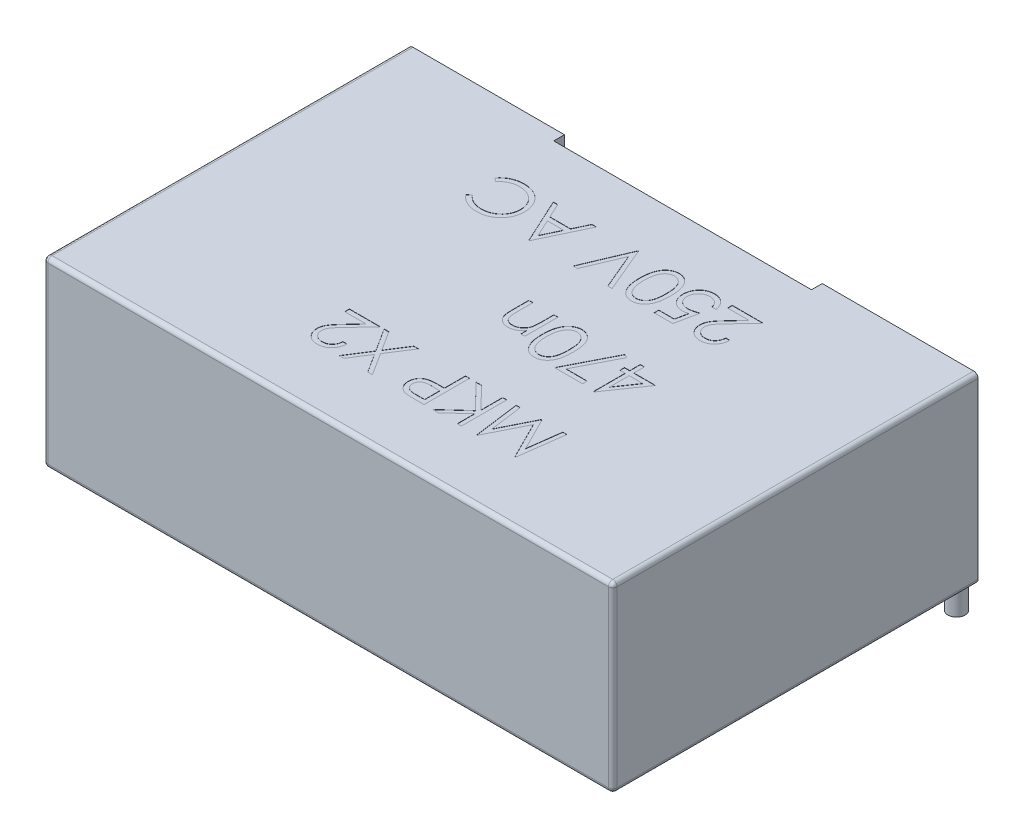
from build123d import *

# Parameters (mm, degrees)
SKETCH1_W          = 26.5
SKETCH1_H          = 8.5
EXTRUDE1_DEPTH     = 17
FILLET1_R          = 0.2
CUT_EXTRUDE1_DEPTH = 0.01
SKETCH5_R          = 0.4
SKETCH6_W          = 12
SKETCH6_H          = 8.5
CUT_EXTRUDE2_DEPTH = 0.5
SKETCH7_W          = 25.5
SKETCH7_H          = 7.563160836
CUT_EXTRUDE4_DEPTH = 0.6


with BuildPart() as part:
    # Sketch1 → Extrude1 (new body)
    with BuildSketch(Plane.XY):
        with Locations((0, 4.25)):
            Rectangle(SKETCH1_W, SKETCH1_H)
    extrude(amount=EXTRUDE1_DEPTH)

    # Fillet1
    fillet1_edges = [part.edges().sort_by_distance(p)[0] for p in [
        (13.25, 4.25, 17),
        (0, 8.5, 17),
        (-13.25, 4.25, 17),
        (0, 0, 17),
        (-13.25, 8.5, 8.5),
        (13.25, 8.5, 8.5),
        (13.25, 0, 8.5),
        (-13.25, 0, 8.5),
    ]]
    fillet(fillet1_edges, radius=FILLET1_R)

    # Sketch3 → Cut-Extrude1 (cut)
    # profile 1 of 15: a face of its own
    with BuildSketch(Plane.XZ.offset(-8.5)):
        Polygon((6.142382605, 12.028879481), (5.86295886, 14.145546148), (5.835822108, 14.145546148), (4.961933887, 12.408794011), (4.090165724, 14.145546148), (4.06260496, 14.145546148), (3.781485169, 12.028879481), (3.972290457, 12.028879481), (4.174968075, 13.551929695), (4.939037252, 12.028879481), (4.981862439, 12.028879481), (5.748899699, 13.555321789), (5.951153304, 12.028879481), align=None)
    # profile 2 of 15: a face of its own
    with BuildSketch(Plane.XZ.offset(-8.5)):
        Polygon((3.347297134, 14.145546148), (3.157339869, 14.145546148), (3.157339869, 13.339499807), (2.274971413, 14.145546148), (2.004027904, 14.145546148), (3.044128732, 13.195759823), (1.922617647, 12.028879481), (2.175752663, 12.028879481), (3.157339869, 13.050323792), (3.157339869, 12.028879481), (3.347297134, 12.028879481), align=None)
    # profile 3 of 15: a face of its own
    with BuildSketch(Plane.XZ.offset(-8.5)):
        with BuildLine():
            Line((1.610544998, 14.145546148), (1.195437492, 14.145546148))
            add(Edge.make_bspline(
                [(1.195437492, 14.145546148), (1.166886135, 14.145514763), (1.112180466, 14.145454628), (1.033733742, 14.143631424), (0.962486904, 14.141196234), (0.898593578, 14.137820518), (0.841857176, 14.133831152), (0.792534428, 14.128235871), (0.750237649, 14.122393692), (0.724894225, 14.116454079), (0.71333613, 14.113745266)],
                knots=[0, 0, 0, 0, 1.415646017, 2.712440637, 3.8905458, 4.950247383, 5.884950622, 6.709939814, 7.411656543, 8, 8, 8, 8], degree=3))
            add(Edge.make_bspline(
                [(0.71333613, 14.113745266), (0.698704803, 14.109740563), (0.669786916, 14.101825523), (0.62811819, 14.085972462), (0.588473722, 14.067175152), (0.550717494, 14.045752103), (0.515313472, 14.020784166), (0.481733438, 13.993283455), (0.450273735, 13.96261503), (0.421111275, 13.929122868), (0.394329516, 13.893369217), (0.371270136, 13.854820345), (0.351961766, 13.814125128), (0.335401406, 13.771311873), (0.323482484, 13.726021059), (0.314503645, 13.67856738), (0.308804594, 13.628955925), (0.308258759, 13.595053052), (0.307980895, 13.577794411)],
                knots=[0, 0, 0, 0, 0.999701418, 1.975846123, 2.934577507, 3.890451536, 4.834027766, 5.787354733, 6.749476667, 7.726910423, 8.712836071, 9.690891519, 10.682875813, 11.679750201, 12.712814741, 13.765529915, 14.8625177, 16, 16, 16, 16], degree=3))
            add(Edge.make_bspline(
                [(0.307980895, 13.577794411), (0.308235757, 13.560390708), (0.308734411, 13.526339188), (0.314719307, 13.476523263), (0.322780899, 13.42891738), (0.335176736, 13.383627093), (0.351411976, 13.340921365), (0.37045717, 13.300147573), (0.393428162, 13.26199939), (0.419822892, 13.226338324), (0.449185047, 13.193130901), (0.481390395, 13.162617763), (0.51630892, 13.13497752), (0.553829648, 13.110148208), (0.594318366, 13.0887056), (0.637161001, 13.069499992), (0.682729942, 13.053370351), (0.714263748, 13.044885504), (0.7302966, 13.040571521)],
                knots=[0, 0, 0, 0, 1.121902311, 2.195077645, 3.232258892, 4.234102512, 5.217864754, 6.176164875, 7.132989551, 8.084763148, 9.034132444, 9.988522005, 10.94243251, 11.903244335, 12.886203696, 13.894208494, 14.929344452, 16, 16, 16, 16], degree=3))
            add(Edge.make_bspline(
                [(0.7302966, 13.040571521), (0.743557417, 13.037751528), (0.772619266, 13.031571349), (0.82048177, 13.024671949), (0.876207789, 13.018783019), (0.939721263, 13.014367569), (1.010965182, 13.010587584), (1.089978085, 13.00758307), (1.176915074, 13.005932159), (1.237555303, 13.005847013), (1.269215537, 13.005802558)],
                knots=[0, 0, 0, 0, 0.601384939, 1.31797006, 2.144135048, 3.087295005, 4.142315834, 5.309527816, 6.595305764, 8, 8, 8, 8], degree=3))
            Line((1.269215537, 13.005802558), (1.420587733, 13.005802558))
            Line((1.420587733, 13.005802558), (1.420587733, 12.028879481))
            Line((1.420587733, 12.028879481), (1.610544998, 12.028879481))
            Line((1.610544998, 12.028879481), (1.610544998, 14.145546148))
        make_face()
        with BuildLine():
            Line((1.420587733, 13.92845213), (1.420587733, 13.222896575))
            Line((1.420587733, 13.222896575), (1.050001461, 13.218232446))
            add(Edge.make_bspline(
                [(1.050001461, 13.218232446), (1.03190703, 13.218223094), (0.996976103, 13.21820504), (0.946517054, 13.220615152), (0.899702866, 13.223397379), (0.856677337, 13.227471008), (0.817421072, 13.233229102), (0.781868614, 13.239041915), (0.750295638, 13.247451349), (0.713345169, 13.258774348), (0.672170954, 13.278085977), (0.627377722, 13.306116625), (0.589416463, 13.341846387), (0.556566826, 13.382019408), (0.530498033, 13.426710787), (0.511414171, 13.474528668), (0.500201185, 13.524982653), (0.49869763, 13.559507384), (0.49793816, 13.576946388)],
                knots=[0, 0, 0, 0, 1.160613943, 2.240541288, 3.23993089, 4.169200891, 5.011653406, 5.7853311, 6.478053781, 7.106038997, 8.262395093, 9.384106736, 10.481365981, 11.59014053, 12.70357646, 13.786202915, 14.881775077, 16, 16, 16, 16], degree=3))
            add(Edge.make_bspline(
                [(0.49793816, 13.576946388), (0.498701761, 13.593963489), (0.500219704, 13.62779138), (0.511502059, 13.677369011), (0.53046093, 13.724682985), (0.556741823, 13.768814327), (0.588637649, 13.808842794), (0.625709157, 13.843614866), (0.667869081, 13.871567991), (0.707086821, 13.889610023), (0.741921824, 13.900625928), (0.772179247, 13.908333522), (0.806342655, 13.914487341), (0.84442317, 13.919470278), (0.886125636, 13.923735943), (0.931808331, 13.92663032), (0.981298201, 13.928324534), (1.01565507, 13.928408568), (1.033465003, 13.92845213)],
                knots=[0, 0, 0, 0, 1.120700087, 2.227813068, 3.331159281, 4.466773991, 5.599788987, 6.693661531, 7.80175334, 8.91857717, 9.525282508, 10.207424825, 10.974604443, 11.810962634, 12.737642355, 13.736264703, 14.826523623, 16, 16, 16, 16], degree=3))
            Line((1.033465003, 13.92845213), (1.420587733, 13.92845213))
        make_face(mode=Mode.SUBTRACT)
    # profile 4 of 15: a face of its own
    with BuildSketch(Plane.XZ.offset(-8.5)):
        Polygon((-0.791057566, 14.145546148), (-1.010271642, 14.145546148), (-1.564455002, 13.27971415), (-2.118638362, 14.145546148), (-2.337852438, 14.145546148), (-1.674274046, 13.108413402), (-2.36498919, 12.028879481), (-2.145775114, 12.028879481), (-1.564455002, 12.937112654), (-0.98313489, 12.028879481), (-0.763920814, 12.028879481), (-1.45505997, 13.108413402), align=None)
    # profile 5 of 15: a face of its own
    with BuildSketch(Plane.XZ.offset(-8.5)):
        with BuildLine():
            Line((-2.812745601, 13.494264096), (-2.622788336, 13.494264096))
            add(Edge.make_bspline(
                [(-2.622788336, 13.494264096), (-2.624026376, 13.519465062), (-2.626457854, 13.568959087), (-2.637844486, 13.64112164), (-2.654137302, 13.710097637), (-2.677173562, 13.775333252), (-2.705782597, 13.837405293), (-2.740090756, 13.896067207), (-2.780727037, 13.951095211), (-2.826813967, 14.001979179), (-2.876869287, 14.048659281), (-2.930878117, 14.088969833), (-2.987632014, 14.123028615), (-3.046958794, 14.151501556), (-3.109527801, 14.172873749), (-3.174771244, 14.188731597), (-3.242975769, 14.19827253), (-3.289445687, 14.199298077), (-3.313079468, 14.199819652)],
                knots=[0, 0, 0, 0, 1.10065271, 2.161652631, 3.183658789, 4.190468796, 5.17591951, 6.163126047, 7.15150782, 8.156236427, 9.156009102, 10.134482811, 11.092018607, 12.041330605, 13.001268258, 13.972401359, 14.968799086, 16, 16, 16, 16], degree=3))
            add(Edge.make_bspline(
                [(-3.313079468, 14.199819652), (-3.336289065, 14.1992763), (-3.381895095, 14.198208632), (-3.448456408, 14.189039819), (-3.511821724, 14.17467939), (-3.571867183, 14.154531495), (-3.628113708, 14.127447579), (-3.680983835, 14.094912877), (-3.731106992, 14.057284694), (-3.776226332, 14.012983578), (-3.817657409, 13.965689755), (-3.853400201, 13.915199451), (-3.884009114, 13.863051264), (-3.909522616, 13.808847542), (-3.928304186, 13.75207792), (-3.942563388, 13.693568898), (-3.9506233, 13.632714845), (-3.951860294, 13.591526595), (-3.95248919, 13.570586212)],
                knots=[0, 0, 0, 0, 1.111607364, 2.184268762, 3.212621178, 4.221274766, 5.211760367, 6.196651075, 7.1921475, 8.207485113, 9.220403448, 10.201281604, 11.166441695, 12.114753415, 13.065576456, 14.026450734, 14.996634279, 16, 16, 16, 16], degree=3))
            add(Edge.make_bspline(
                [(-3.95248919, 13.570586212), (-3.951465169, 13.541105378), (-3.949435098, 13.482661059), (-3.932069737, 13.39677588), (-3.904948275, 13.313564622), (-3.872292731, 13.24659492), (-3.839349872, 13.192629902), (-3.809663617, 13.148198828), (-3.774911089, 13.100358854), (-3.734586473, 13.049270179), (-3.689523927, 12.994532632), (-3.639315285, 12.936179279), (-3.583602513, 12.874813018), (-3.544499515, 12.832899631), (-3.524237321, 12.811181164)],
                knots=[0, 0, 0, 0, 1.184426356, 2.348067706, 3.509069118, 4.696110526, 5.333549288, 6.050745305, 6.844228056, 7.710549037, 8.667450064, 9.695053472, 10.805634456, 12, 12, 12, 12], degree=3))
            Line((-3.524237321, 12.811181164), (-2.994646642, 12.245973498))
            Line((-2.994646642, 12.245973498), (-3.979625942, 12.245973498))
            Line((-3.979625942, 12.245973498), (-3.979625942, 12.028879481))
            Line((-3.979625942, 12.028879481), (-2.541378079, 12.028879481))
            Line((-2.541378079, 12.028879481), (-3.362264831, 12.904887761))
            add(Edge.make_bspline(
                [(-3.362264831, 12.904887761), (-3.382250934, 12.925751022), (-3.420640148, 12.965825078), (-3.47493723, 13.024331535), (-3.523704618, 13.078608638), (-3.567257994, 13.128553836), (-3.604652542, 13.174897689), (-3.637837178, 13.216139248), (-3.664425892, 13.254090749), (-3.693282346, 13.298081501), (-3.721230801, 13.351791807), (-3.745247321, 13.417428848), (-3.759891539, 13.484997234), (-3.761648273, 13.53065799), (-3.762531925, 13.553625742)],
                knots=[0, 0, 0, 0, 1.329631726, 2.553950428, 3.673215718, 4.687767853, 5.603093632, 6.413772471, 7.123043292, 7.734684054, 8.834405432, 9.900288307, 10.943827018, 12, 12, 12, 12], degree=3))
            add(Edge.make_bspline(
                [(-3.762531925, 13.553625742), (-3.762147453, 13.568068302), (-3.761389731, 13.596531814), (-3.754702457, 13.638263868), (-3.744596579, 13.678519732), (-3.730115399, 13.71742323), (-3.711000847, 13.75458322), (-3.687733612, 13.790044934), (-3.660888193, 13.82432826), (-3.629832902, 13.85647335), (-3.595717363, 13.885913889), (-3.559677032, 13.911993693), (-3.52154673, 13.933788774), (-3.481487228, 13.951655556), (-3.439610206, 13.965671143), (-3.39583467, 13.97538276), (-3.350281574, 13.981480263), (-3.319176555, 13.982305262), (-3.303327198, 13.982725635)],
                knots=[0, 0, 0, 0, 0.991446411, 1.95395049, 2.89581595, 3.838931463, 4.798493298, 5.75982156, 6.748411868, 7.785213223, 8.824556874, 9.840280684, 10.836137867, 11.835679398, 12.848801643, 13.863922112, 14.911575587, 16, 16, 16, 16], degree=3))
            add(Edge.make_bspline(
                [(-3.303327198, 13.982725635), (-3.286774361, 13.98229321), (-3.254267322, 13.981444001), (-3.206540098, 13.975503628), (-3.161010127, 13.965255429), (-3.117562881, 13.951239059), (-3.076124846, 13.933423651), (-3.036897543, 13.911233882), (-2.999969034, 13.884755293), (-2.965269898, 13.854734575), (-2.933299778, 13.821310836), (-2.905210477, 13.784051477), (-2.880666811, 13.743636802), (-2.859252655, 13.70017586), (-2.84186231, 13.653274288), (-2.828573785, 13.603098581), (-2.818058883, 13.549866602), (-2.814546111, 13.513106099), (-2.812745601, 13.494264096)],
                knots=[0, 0, 0, 0, 1.031018746, 2.02475058, 2.990194455, 3.934040569, 4.864654155, 5.795059489, 6.735614925, 7.690564532, 8.649604399, 9.611025574, 10.590972636, 11.591080095, 12.624614302, 13.701020113, 14.821632451, 16, 16, 16, 16], degree=3))
        make_face()
    # profile 6 of 15: a face of its own
    with BuildSketch(Plane.XZ.offset(-8.5)):
        Polygon((5.068360836, 9.672041874), (5.029775767, 9.672041874), (5.029775767, 8.206657259), (4.785544998, 8.206657259), (4.785544998, 7.989563242), (5.029775767, 7.989563242), (5.029775767, 7.501101703), (5.219733032, 7.501101703), (5.219733032, 7.989563242), (6.223792861, 7.989563242), align=None)
        Polygon((5.219733032, 8.206657259), (5.219733032, 9.125914737), (5.850662519, 8.206657259), align=None, mode=Mode.SUBTRACT)
    # profile 7 of 15: a face of its own
    with BuildSketch(Plane.XZ.offset(-8.5)):
        Polygon((4.459903972, 9.61776837), (3.157339869, 9.61776837), (4.269946707, 7.446828199), (4.434039255, 7.537142702), (3.478740778, 9.400674353), (4.459903972, 9.400674353), align=None)
    # profile 8 of 15: a face of its own
    with BuildSketch(Plane.XZ.offset(-8.5)):
        with BuildLine():
            add(Edge.make_bspline(
                [(2.967382605, 8.558587013), (2.967184232, 8.592512576), (2.966798889, 8.658413471), (2.962512082, 8.754440374), (2.955390804, 8.844525882), (2.945631536, 8.928674308), (2.933755233, 9.006907375), (2.917901106, 9.079016013), (2.899871458, 9.145333966), (2.878975456, 9.206077491), (2.855397126, 9.262064959), (2.829734502, 9.314331628), (2.800969126, 9.362798416), (2.770744993, 9.408238889), (2.737838645, 9.449909219), (2.703186519, 9.488397876), (2.665436146, 9.52281533), (2.625870803, 9.554169999), (2.584132275, 9.581656108), (2.541410281, 9.605866383), (2.497410765, 9.62654916), (2.452013597, 9.642811471), (2.405626812, 9.656243745), (2.358088253, 9.665429442), (2.309319428, 9.671209096), (2.27640137, 9.671761648), (2.25970699, 9.672041874)],
                knots=[0, 0, 0, 0, 1.646270934, 3.197905019, 4.663502075, 6.030701355, 7.308322542, 8.50163776, 9.611534131, 10.641858119, 11.616356847, 12.558055219, 13.465016945, 14.349605745, 15.204443733, 16.039544428, 16.859896111, 17.680448484, 18.487036065, 19.28249412, 20.06191084, 20.843045899, 21.620316918, 22.403196591, 23.190181807, 24, 24, 24, 24], degree=3))
            add(Edge.make_bspline(
                [(2.25970699, 9.672041874), (2.242873153, 9.671746862), (2.209395948, 9.671160176), (2.159902007, 9.665521411), (2.111551485, 9.656165065), (2.064550515, 9.642908094), (2.018513023, 9.626461185), (1.973799101, 9.605846595), (1.930131008, 9.581850328), (1.888202692, 9.553653983), (1.847553853, 9.522217083), (1.809182942, 9.486679659), (1.773086466, 9.447400543), (1.738811401, 9.404799987), (1.707330158, 9.358060912), (1.677350035, 9.307996236), (1.650515518, 9.253730428), (1.624671215, 9.196168907), (1.60236337, 9.13371898), (1.582245212, 9.066732672), (1.565989836, 8.994418759), (1.552449657, 8.917156649), (1.541960125, 8.834662599), (1.534320384, 8.747113447), (1.530284757, 8.654451591), (1.529524752, 8.591098035), (1.529134741, 8.558587013)],
                knots=[0, 0, 0, 0, 0.810914788, 1.612654377, 2.396697861, 3.181598691, 3.963628158, 4.749916497, 5.551656086, 6.361998678, 7.18212741, 8.025565596, 8.878627764, 9.750805457, 10.657531673, 11.591944965, 12.560506719, 13.57287815, 14.630710178, 15.753379473, 16.941251878, 18.199788006, 19.531962791, 20.947069417, 22.433333509, 24, 24, 24, 24], degree=3))
            add(Edge.make_bspline(
                [(1.529134741, 8.558587013), (1.529528795, 8.526217792), (1.530296592, 8.463147686), (1.534275143, 8.370902763), (1.54211203, 8.283818232), (1.551915213, 8.201685238), (1.5654927, 8.124845631), (1.582187253, 8.053033512), (1.600723401, 7.985938764), (1.623604443, 7.924111044), (1.648648063, 7.866687859), (1.675895729, 7.813065346), (1.705087481, 7.76276954), (1.736891151, 7.716203027), (1.77079012, 7.673035934), (1.807509925, 7.634030229), (1.84601547, 7.598246061), (1.886783931, 7.566404362), (1.929366155, 7.538534028), (1.972884263, 7.513609461), (2.018110404, 7.493511593), (2.064019666, 7.476254688), (2.111268726, 7.463070605), (2.159798686, 7.453954511), (2.209362695, 7.44756106), (2.242867451, 7.447073332), (2.25970699, 7.446828199)],
                knots=[0, 0, 0, 0, 1.561518951, 3.042555995, 4.452378317, 5.7783523, 7.031515105, 8.214008947, 9.334062868, 10.386615937, 11.391082383, 12.354592575, 13.286541444, 14.194233754, 15.072674879, 15.931287219, 16.775624067, 17.606195743, 18.42308326, 19.229000347, 20.022332153, 20.807536673, 21.593273796, 22.3848459, 23.188221202, 24, 24, 24, 24], degree=3))
            add(Edge.make_bspline(
                [(2.25970699, 7.446828199), (2.276400907, 7.447110233), (2.309318052, 7.447666349), (2.358093566, 7.453419891), (2.405435806, 7.462670029), (2.451578386, 7.475621975), (2.49675804, 7.491475709), (2.540359128, 7.512130556), (2.582866441, 7.535918303), (2.624166573, 7.563008867), (2.663483451, 7.594046266), (2.701038322, 7.628375145), (2.735887738, 7.666852161), (2.768323596, 7.708869762), (2.799150783, 7.754041389), (2.827507689, 7.802983786), (2.85373673, 7.855502889), (2.877711603, 7.911938006), (2.898968175, 7.973112653), (2.917744646, 8.03972668), (2.932569875, 8.112368041), (2.945259567, 8.190453306), (2.955494789, 8.274318016), (2.962482405, 8.364007701), (2.9668012, 8.45946647), (2.967185267, 8.524943905), (2.967382605, 8.558587013)],
                knots=[0, 0, 0, 0, 0.810891512, 1.598919785, 2.382837074, 3.152667961, 3.926044502, 4.706494248, 5.493654104, 6.291793342, 7.103789334, 7.925228297, 8.761435821, 9.622817696, 10.50288917, 11.416980706, 12.369136599, 13.353924996, 14.394355917, 15.514179734, 16.714354668, 17.994756427, 19.357759367, 20.818452758, 22.365282078, 24, 24, 24, 24], degree=3))
        make_face()
        with BuildLine():
            add(Edge.make_bspline(
                [(2.77742534, 8.559435036), (2.777353103, 8.531163204), (2.777212905, 8.47629313), (2.773550345, 8.396559348), (2.768560919, 8.322191578), (2.762125468, 8.253095391), (2.752568447, 8.189504669), (2.741860056, 8.130982052), (2.728828592, 8.077837246), (2.713410177, 8.02970557), (2.695848437, 7.985770181), (2.676673939, 7.944887542), (2.656075311, 7.906574704), (2.633022301, 7.871175807), (2.607915572, 7.838575413), (2.58132222, 7.80819651), (2.552249753, 7.781105002), (2.512030823, 7.748613047), (2.45893486, 7.71503719), (2.392035822, 7.685799316), (2.323293473, 7.667425164), (2.276635336, 7.665088512), (2.253346814, 7.663922216)],
                knots=[0, 0, 0, 0, 1.459021318, 2.831673884, 4.118529203, 5.306027144, 6.411944654, 7.436330062, 8.375795394, 9.233974572, 10.042671642, 10.816086306, 11.563610507, 12.285937304, 12.993564865, 13.685989202, 14.367179055, 15.041617293, 16.353048772, 17.594441528, 18.799311195, 20, 20, 20, 20], degree=3))
            add(Edge.make_bspline(
                [(2.253346814, 7.663922216), (2.229907651, 7.664888493), (2.183077717, 7.666819052), (2.114658708, 7.685444955), (2.048237544, 7.713547962), (1.996184514, 7.74677812), (1.956583166, 7.7784243), (1.928209558, 7.80540554), (1.902167271, 7.835616945), (1.87746754, 7.868213186), (1.854813718, 7.903817022), (1.83421363, 7.942257246), (1.815415606, 7.983640606), (1.804705849, 8.012529924), (1.799230227, 8.027300287)],
                knots=[0, 0, 0, 0, 1.353760809, 2.704726607, 4.075137775, 5.516104923, 6.260822281, 7.007110065, 7.778089737, 8.566572457, 9.372053459, 10.217411131, 11.088608312, 12, 12, 12, 12], degree=3))
            add(Edge.make_bspline(
                [(1.799230227, 8.027300287), (1.79284892, 8.046186844), (1.77989213, 8.084534654), (1.763193581, 8.144021244), (1.750042792, 8.206434344), (1.738211613, 8.271400962), (1.730136194, 8.33940021), (1.723636326, 8.410221689), (1.719807768, 8.483918799), (1.71933318, 8.533990056), (1.719092006, 8.559435036)],
                knots=[0, 0, 0, 0, 0.884706709, 1.796334032, 2.740027952, 3.714592787, 4.726048262, 5.777819803, 6.87074269, 8, 8, 8, 8], degree=3))
            add(Edge.make_bspline(
                [(1.719092006, 8.559435036), (1.71942474, 8.584875902), (1.720075638, 8.634643673), (1.722563621, 8.707528477), (1.728988354, 8.776754218), (1.736124011, 8.842619123), (1.746645188, 8.904758592), (1.757989195, 8.963692824), (1.773229928, 9.018691701), (1.789509982, 9.070616305), (1.808142936, 9.118876701), (1.82865388, 9.163697896), (1.85055942, 9.205296277), (1.874352108, 9.243557713), (1.899749497, 9.278653584), (1.92742192, 9.30988022), (1.956271707, 9.338205434), (1.996680196, 9.370537559), (2.049581314, 9.403504156), (2.115407015, 9.433842496), (2.183908786, 9.451264654), (2.230217494, 9.453721008), (2.253346814, 9.454947857)],
                knots=[0, 0, 0, 0, 1.31362396, 2.569729283, 3.763502607, 4.902122613, 5.988968491, 7.01645872, 7.998833611, 8.933434873, 9.825090667, 10.667526885, 11.477055099, 12.250526234, 12.991942729, 13.710640831, 14.402115721, 15.076753259, 16.378508321, 17.609869233, 18.806226677, 20, 20, 20, 20], degree=3))
            add(Edge.make_bspline(
                [(2.253346814, 9.454947857), (2.276757505, 9.453719315), (2.323621537, 9.451259994), (2.3928353, 9.433907407), (2.459180313, 9.403661471), (2.51194154, 9.370428369), (2.552378211, 9.338776153), (2.58085203, 9.311328154), (2.607549954, 9.281303991), (2.632144229, 9.248403785), (2.655179177, 9.213046158), (2.676334361, 9.174952953), (2.695394841, 9.133931128), (2.71298406, 9.090015474), (2.728449508, 9.041887951), (2.741206334, 8.988808607), (2.752991361, 8.930472129), (2.761334214, 8.866536998), (2.768750867, 8.797423506), (2.773517206, 8.72287008), (2.777225156, 8.643002574), (2.777357275, 8.587848797), (2.77742534, 8.559435036)],
                knots=[0, 0, 0, 0, 1.207732386, 2.417664972, 3.655092373, 4.956220595, 5.625982001, 6.301752483, 6.994047911, 7.697131622, 8.419323945, 9.170223765, 9.943494443, 10.752040957, 11.610060368, 12.549350801, 13.567764191, 14.679664412, 15.874934091, 17.154273443, 18.533957287, 20, 20, 20, 20], degree=3))
        make_face(mode=Mode.SUBTRACT)
    # profile 9 of 15: a face of its own
    with BuildSketch(Plane.XZ.offset(-8.5)):
        with BuildLine():
            Line((1.203493716, 9.047896575), (1.013536451, 9.047896575))
            Line((1.013536451, 9.047896575), (1.013536451, 8.768896842))
            add(Edge.make_bspline(
                [(1.013536451, 8.768896842), (0.993254167, 8.794201727), (0.953895687, 8.843306738), (0.888348971, 8.907847276), (0.819077183, 8.961033198), (0.746504543, 9.003429302), (0.670532532, 9.035388928), (0.591624245, 9.05847023), (0.509307256, 9.072310102), (0.453327811, 9.074118479), (0.425008139, 9.075033327)],
                knots=[0, 0, 0, 0, 1.12780773, 2.188550248, 3.19190651, 4.159438251, 5.104880172, 6.052711206, 7.014878035, 8, 8, 8, 8], degree=3))
            add(Edge.make_bspline(
                [(0.425008139, 9.075033327), (0.396384374, 9.073977899), (0.340360763, 9.071912173), (0.25879165, 9.055573507), (0.18260774, 9.027666615), (0.112080675, 8.989438363), (0.048503741, 8.941900162), (-0.007330812, 8.886517408), (-0.053512394, 8.822814158), (-0.084474609, 8.763714916), (-0.104870596, 8.711288835), (-0.117711105, 8.666387229), (-0.128615556, 8.616362443), (-0.138069041, 8.561365644), (-0.144465676, 8.5010115), (-0.149510776, 8.43554742), (-0.153126462, 8.364994607), (-0.153269916, 8.316198409), (-0.153343891, 8.291035597)],
                knots=[0, 0, 0, 0, 1.235846778, 2.418850247, 3.575807741, 4.728682307, 5.871620074, 6.994088408, 8.11269785, 9.256955736, 9.865816715, 10.540099792, 11.271859618, 12.076849838, 12.949306005, 13.892391288, 14.913166135, 16, 16, 16, 16], degree=3))
            Line((-0.153343891, 8.291035597), (-0.153343891, 7.501101703))
            Line((-0.153343891, 7.501101703), (0.036613374, 7.501101703))
            Line((0.036613374, 7.501101703), (0.036613374, 8.22870587))
            add(Edge.make_bspline(
                [(0.036613374, 8.22870587), (0.036730219, 8.249765158), (0.036953723, 8.290047992), (0.037658662, 8.347723544), (0.039357926, 8.400027332), (0.041745715, 8.446834311), (0.045240652, 8.488099536), (0.04888291, 8.523907051), (0.053336968, 8.554211394), (0.057305968, 8.572454086), (0.059085997, 8.580635624)],
                knots=[0, 0, 0, 0, 1.430800155, 2.736877192, 3.918605307, 4.986035426, 5.920637409, 6.731861385, 7.431261377, 8, 8, 8, 8], degree=3))
            add(Edge.make_bspline(
                [(0.059085997, 8.580635624), (0.065511913, 8.604651436), (0.077879815, 8.650874443), (0.108440843, 8.713572742), (0.147033228, 8.766911646), (0.19414288, 8.810561378), (0.249314749, 8.84453136), (0.312395736, 8.868101323), (0.382777104, 8.882843162), (0.432279517, 8.884310999), (0.458081055, 8.885076062)],
                knots=[0, 0, 0, 0, 1.084156227, 2.086665306, 3.027808233, 3.945421172, 4.874247719, 5.839848303, 6.874090471, 8, 8, 8, 8], degree=3))
            add(Edge.make_bspline(
                [(0.458081055, 8.885076062), (0.473361988, 8.884788193), (0.503602558, 8.884218506), (0.548445637, 8.878502721), (0.591942637, 8.869154036), (0.634530096, 8.856533479), (0.675356238, 8.839199631), (0.715732738, 8.819527107), (0.75413921, 8.795005093), (0.791394598, 8.767675527), (0.8260552, 8.73738953), (0.858306148, 8.705431183), (0.887055331, 8.671397842), (0.913101626, 8.635837874), (0.935585623, 8.598262905), (0.955212014, 8.559035443), (0.971864554, 8.518103858), (0.980139325, 8.489695131), (0.98427964, 8.475480709)],
                knots=[0, 0, 0, 0, 1.023777757, 2.026029729, 3.023749952, 4.003683103, 4.997618607, 5.993177895, 7.010360494, 8.046726602, 9.087585522, 10.09234134, 11.086953743, 12.070360549, 13.043493632, 14.017870808, 15.008233677, 16, 16, 16, 16], degree=3))
            add(Edge.make_bspline(
                [(0.98427964, 8.475480709), (0.986662189, 8.46504542), (0.991848875, 8.442328341), (0.997450893, 8.405048144), (1.002535474, 8.361922588), (1.006791159, 8.313001996), (1.00939491, 8.258115091), (1.012233903, 8.197496275), (1.013267478, 8.130903832), (1.013444282, 8.08454176), (1.013536451, 8.060373204)],
                knots=[0, 0, 0, 0, 0.615963638, 1.340920617, 2.168419149, 3.115676021, 4.16674242, 5.331190069, 6.6087489, 8, 8, 8, 8], degree=3))
            Line((1.013536451, 8.060373204), (1.013536451, 7.501101703))
            Line((1.013536451, 7.501101703), (1.203493716, 7.501101703))
            Line((1.203493716, 7.501101703), (1.203493716, 9.047896575))
        make_face()
    # profile 10 of 15: a face of its own
    with BuildSketch(Plane.XZ.offset(-8.5)):
        with BuildLine():
            Line((5.95242534, 4.438708541), (6.142382605, 4.438708541))
            add(Edge.make_bspline(
                [(6.142382605, 4.438708541), (6.141144564, 4.463909506), (6.138713086, 4.513403532), (6.127326454, 4.585566085), (6.111033638, 4.654542082), (6.087997378, 4.719777696), (6.059388343, 4.781849737), (6.025080184, 4.840511651), (5.984443903, 4.895539656), (5.938356973, 4.946423623), (5.888301653, 4.993103725), (5.834292823, 5.033414277), (5.777538926, 5.067473059), (5.718212146, 5.095946001), (5.655643139, 5.117318193), (5.590399696, 5.133176042), (5.522195171, 5.142716975), (5.475725253, 5.143742521), (5.452091472, 5.144264096)],
                knots=[0, 0, 0, 0, 1.10065271, 2.161652631, 3.183658789, 4.190468796, 5.17591951, 6.163126047, 7.15150782, 8.156236427, 9.156009102, 10.134482811, 11.092018607, 12.041330605, 13.001268258, 13.972401359, 14.968799086, 16, 16, 16, 16], degree=3))
            add(Edge.make_bspline(
                [(5.452091472, 5.144264096), (5.428881875, 5.143720744), (5.383275845, 5.142653076), (5.316714532, 5.133484263), (5.253349216, 5.119123834), (5.193303757, 5.098975939), (5.137057232, 5.071892024), (5.084187105, 5.039357322), (5.034063948, 5.001729138), (4.988944608, 4.957428022), (4.947513531, 4.910134199), (4.911770739, 4.859643896), (4.881161826, 4.807495709), (4.855648324, 4.753291987), (4.836866754, 4.696522365), (4.822607552, 4.638013342), (4.81454764, 4.57715929), (4.813310646, 4.53597104), (4.81268175, 4.515030656)],
                knots=[0, 0, 0, 0, 1.111607364, 2.184268762, 3.212621178, 4.221274766, 5.211760367, 6.196651075, 7.1921475, 8.207485113, 9.220403448, 10.201281604, 11.166441695, 12.114753415, 13.065576456, 14.026450734, 14.996634279, 16, 16, 16, 16], degree=3))
            add(Edge.make_bspline(
                [(4.81268175, 4.515030656), (4.813705771, 4.485549823), (4.815735842, 4.427105503), (4.833101203, 4.341220324), (4.860222665, 4.258009066), (4.892878209, 4.191039364), (4.925821068, 4.137074347), (4.955507323, 4.092643273), (4.990259851, 4.044803299), (5.030584467, 3.993714623), (5.075647013, 3.938977076), (5.125855655, 3.880623724), (5.181568427, 3.819257463), (5.220671426, 3.777344075), (5.240933619, 3.755625608)],
                knots=[0, 0, 0, 0, 1.184426356, 2.348067706, 3.509069118, 4.696110526, 5.333549288, 6.050745305, 6.844228056, 7.710549037, 8.667450064, 9.695053472, 10.805634456, 12, 12, 12, 12], degree=3))
            Line((5.240933619, 3.755625608), (5.770524298, 3.190417942))
            Line((5.770524298, 3.190417942), (4.785544998, 3.190417942))
            Line((4.785544998, 3.190417942), (4.785544998, 2.973323925))
            Line((4.785544998, 2.973323925), (6.223792861, 2.973323925))
            Line((6.223792861, 2.973323925), (5.402906109, 3.849332205))
            add(Edge.make_bspline(
                [(5.402906109, 3.849332205), (5.382920006, 3.870195467), (5.344530792, 3.910269522), (5.29023371, 3.968775979), (5.241466322, 4.023053083), (5.197912946, 4.072998281), (5.160518398, 4.119342134), (5.127333762, 4.160583693), (5.100745048, 4.198535194), (5.071888594, 4.242525946), (5.043940139, 4.296236252), (5.019923619, 4.361873292), (5.005279401, 4.429441679), (5.003522667, 4.475102434), (5.002639015, 4.498070186)],
                knots=[0, 0, 0, 0, 1.329631726, 2.553950428, 3.673215718, 4.687767853, 5.603093632, 6.413772471, 7.123043292, 7.734684054, 8.834405432, 9.900288307, 10.943827018, 12, 12, 12, 12], degree=3))
            add(Edge.make_bspline(
                [(5.002639015, 4.498070186), (5.003023488, 4.512512746), (5.003781209, 4.540976258), (5.010468484, 4.582708313), (5.020574361, 4.622964176), (5.035055541, 4.661867674), (5.054170093, 4.699027664), (5.077437328, 4.734489378), (5.104282747, 4.768772705), (5.135338039, 4.800917795), (5.169453577, 4.830358333), (5.205493909, 4.856438137), (5.24362421, 4.878233218), (5.283683712, 4.8961), (5.325560734, 4.910115588), (5.369336271, 4.919827205), (5.414889366, 4.925924707), (5.445994385, 4.926749706), (5.461843742, 4.927170079)],
                knots=[0, 0, 0, 0, 0.991446411, 1.95395049, 2.89581595, 3.838931463, 4.798493298, 5.75982156, 6.748411868, 7.785213223, 8.824556874, 9.840280684, 10.836137867, 11.835679398, 12.848801643, 13.863922112, 14.911575587, 16, 16, 16, 16], degree=3))
            add(Edge.make_bspline(
                [(5.461843742, 4.927170079), (5.478396579, 4.926737655), (5.510903618, 4.925888445), (5.558630843, 4.919948072), (5.604160813, 4.909699873), (5.647608059, 4.895683504), (5.689046094, 4.877868095), (5.728273397, 4.855678326), (5.765201906, 4.829199737), (5.799901042, 4.79917902), (5.831871162, 4.76575528), (5.859960464, 4.728495922), (5.884504129, 4.688081247), (5.905918285, 4.644620304), (5.923308631, 4.597718732), (5.936597155, 4.547543025), (5.947112057, 4.494311047), (5.950624829, 4.457550543), (5.95242534, 4.438708541)],
                knots=[0, 0, 0, 0, 1.031018746, 2.02475058, 2.990194455, 3.934040569, 4.864654155, 5.795059489, 6.735614925, 7.690564532, 8.649604399, 9.611025574, 10.590972636, 11.591080095, 12.624614302, 13.701020113, 14.821632451, 16, 16, 16, 16], degree=3))
        make_face()
    # profile 11 of 15: a face of its own
    with BuildSketch(Plane.XZ.offset(-8.5)):
        with BuildLine():
            Line((3.265886878, 5.089990592), (3.265886878, 4.872896575))
            Line((3.265886878, 4.872896575), (3.985858833, 4.872896575))
            Line((3.985858833, 4.872896575), (4.099917994, 4.316169144))
            add(Edge.make_bspline(
                [(4.099917994, 4.316169144), (4.077508013, 4.322356023), (4.034092219, 4.334342122), (3.970011732, 4.347650374), (3.909177399, 4.355672809), (3.869701342, 4.35676822), (3.850599084, 4.357298284)],
                knots=[0, 0, 0, 0, 1.100273476, 2.13160584, 3.095893838, 4, 4, 4, 4], degree=3))
            add(Edge.make_bspline(
                [(3.850599084, 4.357298284), (3.826962727, 4.356786695), (3.780487744, 4.355780781), (3.712488952, 4.346121615), (3.647578108, 4.330917953), (3.58589096, 4.309678399), (3.527313389, 4.282518703), (3.47238434, 4.248591596), (3.420279316, 4.208959534), (3.371933081, 4.163393741), (3.328073142, 4.113245906), (3.289509901, 4.059326623), (3.256754429, 4.002159894), (3.230410544, 3.941199525), (3.209374304, 3.877119466), (3.195372859, 3.809245476), (3.186049421, 3.738217327), (3.185007788, 3.689652182), (3.184476622, 3.664887093)],
                knots=[0, 0, 0, 0, 1.052922333, 2.070308379, 3.05430497, 4.020497103, 4.973039431, 5.925935799, 6.892292201, 7.88610001, 8.88166317, 9.857072816, 10.836096531, 11.812156883, 12.81219415, 13.836441305, 14.89672472, 16, 16, 16, 16], degree=3))
            add(Edge.make_bspline(
                [(3.184476622, 3.664887093), (3.184878834, 3.647637941), (3.185677823, 3.613372743), (3.189740968, 3.562485536), (3.197563997, 3.512675633), (3.208067335, 3.463936424), (3.22170013, 3.416360185), (3.238203511, 3.369810737), (3.258400156, 3.324577808), (3.280553416, 3.280233403), (3.305497715, 3.23778002), (3.333182812, 3.198078013), (3.362432419, 3.160531805), (3.393905066, 3.125544071), (3.427893287, 3.093344722), (3.463985457, 3.063742667), (3.501893578, 3.036237291), (3.542204129, 3.011945096), (3.584018869, 2.989591309), (3.627941648, 2.971252788), (3.672972643, 2.954857374), (3.719759972, 2.941788755), (3.768197659, 2.931548591), (3.818365547, 2.924593466), (3.870000524, 2.919527715), (3.905001126, 2.919210604), (3.922681082, 2.919050421)],
                knots=[0, 0, 0, 0, 1.056347294, 2.098418968, 3.122841568, 4.141288669, 5.149314143, 6.15115421, 7.162517403, 8.180376062, 9.185164535, 10.17417709, 11.141909838, 12.097768115, 13.052685741, 14.0056014, 14.954263652, 15.917497458, 16.885230207, 17.854509472, 18.828990115, 19.81800267, 20.826176721, 21.857883937, 22.917946725, 24, 24, 24, 24], degree=3))
            add(Edge.make_bspline(
                [(3.922681082, 2.919050421), (3.943771658, 2.919468214), (3.985264875, 2.920290171), (4.046055884, 2.928888969), (4.104545193, 2.94120429), (4.160261969, 2.959731939), (4.213705543, 2.982947112), (4.264156424, 3.012287845), (4.312903727, 3.045537112), (4.357965768, 3.084774278), (4.399788751, 3.127661381), (4.437227449, 3.174202431), (4.470570136, 3.223629284), (4.499282869, 3.276181977), (4.52377453, 3.331722422), (4.543015022, 3.390458713), (4.558544313, 3.452083953), (4.565114096, 3.494510124), (4.568450981, 3.516058968)],
                knots=[0, 0, 0, 0, 1.0467383, 2.05933395, 3.04377827, 4.011590433, 4.970194871, 5.932262533, 6.905835911, 7.896367577, 8.894135286, 9.877477877, 10.858688626, 11.851381753, 12.8477658, 13.868841284, 14.917554742, 16, 16, 16, 16], degree=3))
            Line((4.568450981, 3.516058968), (4.378493716, 3.516058968))
            add(Edge.make_bspline(
                [(4.378493716, 3.516058968), (4.373819779, 3.495874161), (4.364836212, 3.457077841), (4.345117497, 3.40256984), (4.321008134, 3.353995833), (4.29233979, 3.310713275), (4.258140486, 3.272970691), (4.219115546, 3.239335611), (4.175362399, 3.208991604), (4.126743636, 3.183698788), (4.075451917, 3.162127685), (4.02176889, 3.147763564), (3.967156261, 3.137663501), (3.93021839, 3.136652483), (3.911656777, 3.136144438)],
                knots=[0, 0, 0, 0, 1.136247022, 2.183929868, 3.172523383, 4.106158343, 5.02341133, 5.958108904, 6.928429099, 7.938127109, 8.96079061, 9.975095812, 10.982467395, 12, 12, 12, 12], degree=3))
            add(Edge.make_bspline(
                [(3.911656777, 3.136144438), (3.893539051, 3.136640813), (3.8578651, 3.13761818), (3.80536488, 3.145140821), (3.754678047, 3.15672659), (3.706304741, 3.174065026), (3.659398476, 3.195137785), (3.615145768, 3.222179759), (3.572266409, 3.253300818), (3.532093204, 3.288955542), (3.495299823, 3.328246738), (3.462790169, 3.370264019), (3.435710797, 3.415087064), (3.412890646, 3.461939875), (3.395562222, 3.511335955), (3.383200295, 3.563043809), (3.375941303, 3.617191154), (3.374942732, 3.654123546), (3.374433887, 3.672943316)],
                knots=[0, 0, 0, 0, 1.027316725, 2.022795036, 3.002884548, 3.971462791, 4.93288096, 5.914575861, 6.907176829, 7.935150275, 8.956128384, 9.956726525, 10.942570165, 11.921478529, 12.907843606, 13.90538589, 14.932640048, 16, 16, 16, 16], degree=3))
            add(Edge.make_bspline(
                [(3.374433887, 3.672943316), (3.37483211, 3.689922461), (3.375611575, 3.723156722), (3.381980063, 3.771779099), (3.39305747, 3.817785177), (3.408432864, 3.861397119), (3.427954281, 3.902656057), (3.451809908, 3.941604575), (3.480447439, 3.977729322), (3.513160152, 4.011047199), (3.548997158, 4.041796243), (3.588575041, 4.068009095), (3.631065568, 4.090061083), (3.675956802, 4.10909173), (3.724316526, 4.1227598), (3.775187061, 4.13302133), (3.829117737, 4.138957288), (3.865990486, 4.139780906), (3.884944036, 4.140204267)],
                knots=[0, 0, 0, 0, 1.045622112, 2.046656509, 3.013763289, 3.955457236, 4.890082067, 5.820317437, 6.762574623, 7.722996705, 8.69280354, 9.665887285, 10.63943826, 11.638615906, 12.663482002, 13.728887084, 14.832589034, 16, 16, 16, 16], degree=3))
            add(Edge.make_bspline(
                [(3.884944036, 4.140204267), (3.901350579, 4.139853148), (3.935225927, 4.139128175), (3.987188779, 4.133790246), (4.041793774, 4.125178863), (4.098831588, 4.113333847), (4.158473514, 4.097833148), (4.22059369, 4.079258188), (4.285322727, 4.057050122), (4.32893678, 4.040278736), (4.351356963, 4.031657259)],
                knots=[0, 0, 0, 0, 0.817624296, 1.688186739, 2.600797293, 3.572016777, 4.590301741, 5.671205678, 6.80286297, 8, 8, 8, 8], degree=3))
            Line((4.351356963, 4.031657259), (4.134262946, 5.089990592))
            Line((4.134262946, 5.089990592), (3.265886878, 5.089990592))
        make_face()
    # profile 12 of 15: a face of its own
    with BuildSketch(Plane.XZ.offset(-8.5)):
        with BuildLine():
            add(Edge.make_bspline(
                [(2.967382605, 4.030809235), (2.967184232, 4.064734798), (2.966798889, 4.130635693), (2.962512082, 4.226662596), (2.955390804, 4.316748104), (2.945631536, 4.40089653), (2.933755233, 4.479129597), (2.917901106, 4.551238236), (2.899871458, 4.617556188), (2.878975456, 4.678299713), (2.855397126, 4.734287181), (2.829734502, 4.78655385), (2.800969126, 4.835020638), (2.770744993, 4.880461111), (2.737838645, 4.922131441), (2.703186519, 4.960620099), (2.665436146, 4.995037552), (2.625870803, 5.026392221), (2.584132275, 5.05387833), (2.541410281, 5.078088605), (2.497410765, 5.098771382), (2.452013597, 5.115033693), (2.405626812, 5.128465967), (2.358088253, 5.137651664), (2.309319428, 5.143431319), (2.27640137, 5.14398387), (2.25970699, 5.144264096)],
                knots=[0, 0, 0, 0, 1.646270934, 3.197905019, 4.663502075, 6.030701355, 7.308322542, 8.50163776, 9.611534131, 10.641858119, 11.616356847, 12.558055219, 13.465016945, 14.349605745, 15.204443733, 16.039544428, 16.859896111, 17.680448484, 18.487036065, 19.28249412, 20.06191084, 20.843045899, 21.620316918, 22.403196591, 23.190181807, 24, 24, 24, 24], degree=3))
            add(Edge.make_bspline(
                [(2.25970699, 5.144264096), (2.242873153, 5.143969084), (2.209395948, 5.143382398), (2.159902007, 5.137743633), (2.111551485, 5.128387287), (2.064550515, 5.115130317), (2.018513023, 5.098683407), (1.973799101, 5.078068818), (1.930131008, 5.05407255), (1.888202692, 5.025876205), (1.847553853, 4.994439305), (1.809182942, 4.958901881), (1.773086466, 4.919622765), (1.738811401, 4.87702221), (1.707330158, 4.830283135), (1.677350035, 4.780218459), (1.650515518, 4.72595265), (1.624671215, 4.668391129), (1.60236337, 4.605941202), (1.582245212, 4.538954894), (1.565989836, 4.466640981), (1.552449657, 4.389378871), (1.541960125, 4.306884822), (1.534320384, 4.219335669), (1.530284757, 4.126673814), (1.529524752, 4.063320257), (1.529134741, 4.030809235)],
                knots=[0, 0, 0, 0, 0.810914788, 1.612654377, 2.396697861, 3.181598691, 3.963628158, 4.749916497, 5.551656086, 6.361998678, 7.18212741, 8.025565596, 8.878627764, 9.750805457, 10.657531673, 11.591944965, 12.560506719, 13.57287815, 14.630710178, 15.753379473, 16.941251878, 18.199788006, 19.531962791, 20.947069417, 22.433333509, 24, 24, 24, 24], degree=3))
            add(Edge.make_bspline(
                [(1.529134741, 4.030809235), (1.529528795, 3.998440015), (1.530296592, 3.935369908), (1.534275143, 3.843124985), (1.54211203, 3.756040454), (1.551915213, 3.67390746), (1.5654927, 3.597067853), (1.582187253, 3.525255734), (1.600723401, 3.458160986), (1.623604443, 3.396333266), (1.648648063, 3.338910082), (1.675895729, 3.285287568), (1.705087481, 3.234991763), (1.736891151, 3.188425249), (1.77079012, 3.145258156), (1.807509925, 3.106252451), (1.84601547, 3.070468283), (1.886783931, 3.038626584), (1.929366155, 3.01075625), (1.972884263, 2.985831684), (2.018110404, 2.965733816), (2.064019666, 2.94847691), (2.111268726, 2.935292827), (2.159798686, 2.926176733), (2.209362695, 2.919783282), (2.242867451, 2.919295554), (2.25970699, 2.919050421)],
                knots=[0, 0, 0, 0, 1.561518951, 3.042555995, 4.452378317, 5.7783523, 7.031515105, 8.214008947, 9.334062868, 10.386615937, 11.391082383, 12.354592575, 13.286541444, 14.194233754, 15.072674879, 15.931287219, 16.775624067, 17.606195743, 18.42308326, 19.229000347, 20.022332153, 20.807536673, 21.593273796, 22.3848459, 23.188221202, 24, 24, 24, 24], degree=3))
            add(Edge.make_bspline(
                [(2.25970699, 2.919050421), (2.276400907, 2.919332455), (2.309318052, 2.919888571), (2.358093566, 2.925642113), (2.405435806, 2.934892251), (2.451578386, 2.947844197), (2.49675804, 2.963697932), (2.540359128, 2.984352778), (2.582866441, 3.008140525), (2.624166573, 3.035231089), (2.663483451, 3.066268488), (2.701038322, 3.100597368), (2.735887738, 3.139074383), (2.768323596, 3.181091984), (2.799150783, 3.226263612), (2.827507689, 3.275206009), (2.85373673, 3.327725111), (2.877711603, 3.384160229), (2.898968175, 3.445334875), (2.917744646, 3.511948902), (2.932569875, 3.584590263), (2.945259567, 3.662675528), (2.955494789, 3.746540238), (2.962482405, 3.836229923), (2.9668012, 3.931688693), (2.967185267, 3.997166127), (2.967382605, 4.030809235)],
                knots=[0, 0, 0, 0, 0.810891512, 1.598919785, 2.382837074, 3.152667961, 3.926044502, 4.706494248, 5.493654104, 6.291793342, 7.103789334, 7.925228297, 8.761435821, 9.622817696, 10.50288917, 11.416980706, 12.369136599, 13.353924996, 14.394355917, 15.514179734, 16.714354668, 17.994756427, 19.357759367, 20.818452758, 22.365282078, 24, 24, 24, 24], degree=3))
        make_face()
        with BuildLine():
            add(Edge.make_bspline(
                [(2.77742534, 4.031657259), (2.777353103, 4.003385426), (2.777212905, 3.948515352), (2.773550345, 3.86878157), (2.768560919, 3.7944138), (2.762125468, 3.725317614), (2.752568447, 3.661726892), (2.741860056, 3.603204274), (2.728828592, 3.550059468), (2.713410177, 3.501927793), (2.695848437, 3.457992403), (2.676673939, 3.417109764), (2.656075311, 3.378796926), (2.633022301, 3.34339803), (2.607915572, 3.310797635), (2.58132222, 3.280418732), (2.552249753, 3.253327224), (2.512030823, 3.220835269), (2.45893486, 3.187259412), (2.392035822, 3.158021538), (2.323293473, 3.139647386), (2.276635336, 3.137310734), (2.253346814, 3.136144438)],
                knots=[0, 0, 0, 0, 1.459021318, 2.831673884, 4.118529203, 5.306027144, 6.411944654, 7.436330062, 8.375795394, 9.233974572, 10.042671642, 10.816086306, 11.563610507, 12.285937304, 12.993564865, 13.685989202, 14.367179055, 15.041617293, 16.353048772, 17.594441528, 18.799311195, 20, 20, 20, 20], degree=3))
            add(Edge.make_bspline(
                [(2.253346814, 3.136144438), (2.229907651, 3.137110715), (2.183077717, 3.139041274), (2.114658708, 3.157667177), (2.048237544, 3.185770184), (1.996184514, 3.219000342), (1.956583166, 3.250646523), (1.928209558, 3.277627762), (1.902167271, 3.307839168), (1.87746754, 3.340435409), (1.854813718, 3.376039244), (1.83421363, 3.414479468), (1.815415606, 3.455862828), (1.804705849, 3.484752147), (1.799230227, 3.49952251)],
                knots=[0, 0, 0, 0, 1.353760809, 2.704726607, 4.075137775, 5.516104923, 6.260822281, 7.007110065, 7.778089737, 8.566572457, 9.372053459, 10.217411131, 11.088608312, 12, 12, 12, 12], degree=3))
            add(Edge.make_bspline(
                [(1.799230227, 3.49952251), (1.79284892, 3.518409066), (1.77989213, 3.556756876), (1.763193581, 3.616243466), (1.750042792, 3.678656566), (1.738211613, 3.743623184), (1.730136194, 3.811622432), (1.723636326, 3.882443912), (1.719807768, 3.956141021), (1.71933318, 4.006212278), (1.719092006, 4.031657259)],
                knots=[0, 0, 0, 0, 0.884706709, 1.796334032, 2.740027952, 3.714592787, 4.726048262, 5.777819803, 6.87074269, 8, 8, 8, 8], degree=3))
            add(Edge.make_bspline(
                [(1.719092006, 4.031657259), (1.71942474, 4.057098124), (1.720075638, 4.106865895), (1.722563621, 4.179750699), (1.728988354, 4.248976441), (1.736124011, 4.314841345), (1.746645188, 4.376980814), (1.757989195, 4.435915046), (1.773229928, 4.490913923), (1.789509982, 4.542838528), (1.808142936, 4.591098923), (1.82865388, 4.635920118), (1.85055942, 4.677518499), (1.874352108, 4.715779935), (1.899749497, 4.750875806), (1.92742192, 4.782102442), (1.956271707, 4.810427656), (1.996680196, 4.842759781), (2.049581314, 4.875726378), (2.115407015, 4.906064719), (2.183908786, 4.923486877), (2.230217494, 4.92594323), (2.253346814, 4.927170079)],
                knots=[0, 0, 0, 0, 1.31362396, 2.569729283, 3.763502607, 4.902122613, 5.988968491, 7.01645872, 7.998833611, 8.933434873, 9.825090667, 10.667526885, 11.477055099, 12.250526234, 12.991942729, 13.710640831, 14.402115721, 15.076753259, 16.378508321, 17.609869233, 18.806226677, 20, 20, 20, 20], degree=3))
            add(Edge.make_bspline(
                [(2.253346814, 4.927170079), (2.276757505, 4.925941538), (2.323621537, 4.923482216), (2.3928353, 4.90612963), (2.459180313, 4.875883693), (2.51194154, 4.842650592), (2.552378211, 4.810998375), (2.58085203, 4.783550376), (2.607549954, 4.753526213), (2.632144229, 4.720626007), (2.655179177, 4.68526838), (2.676334361, 4.647175175), (2.695394841, 4.60615335), (2.71298406, 4.562237696), (2.728449508, 4.514110173), (2.741206334, 4.461030829), (2.752991361, 4.402694352), (2.761334214, 4.338759221), (2.768750867, 4.269645728), (2.773517206, 4.195092302), (2.777225156, 4.115224796), (2.777357275, 4.060071019), (2.77742534, 4.031657259)],
                knots=[0, 0, 0, 0, 1.207732386, 2.417664972, 3.655092373, 4.956220595, 5.625982001, 6.301752483, 6.994047911, 7.697131622, 8.419323945, 9.170223765, 9.943494443, 10.752040957, 11.610060368, 12.549350801, 13.567764191, 14.679664412, 15.874934091, 17.154273443, 18.533957287, 20, 20, 20, 20], degree=3))
        make_face(mode=Mode.SUBTRACT)
    # profile 13 of 15: a face of its own
    with BuildSketch(Plane.XZ.offset(-8.5)):
        Polygon((1.312040724, 5.089990592), (1.108515083, 5.089990592), (0.402959528, 3.421928359), (-0.302596028, 5.089990592), (-0.506121669, 5.089990592), (0.389391152, 2.973323925), (0.416527904, 2.973323925), align=None)
    # profile 14 of 15: a face of its own
    with BuildSketch(Plane.XZ.offset(-8.5)):
        Polygon((-2.568514831, 5.089990592), (-3.545437908, 2.973323925), (-3.338944185, 2.973323925), (-3.026023512, 3.651742729), (-2.066484917, 3.651742729), (-1.744659997, 2.973323925), (-1.53731825, 2.973323925), (-2.541378079, 5.089990592), align=None)
        Polygon((-2.552826397, 4.677427157), (-2.169519773, 3.868836746), (-2.925956738, 3.868836746), align=None, mode=Mode.SUBTRACT)
    # profile 15 of 15: a face of its own
    with BuildSketch(Plane.XZ.offset(-8.5)):
        with BuildLine():
            Line((-5.879198592, 4.701595827), (-5.712985985, 4.574392301))
            add(Edge.make_bspline(
                [(-5.712985985, 4.574392301), (-5.701129091, 4.58852315), (-5.677575159, 4.616594332), (-5.63968126, 4.656012438), (-5.600189314, 4.692942381), (-5.559114417, 4.72756009), (-5.515717235, 4.758654991), (-5.471049038, 4.787847515), (-5.424362601, 4.814014195), (-5.359803219, 4.84574181), (-5.27534952, 4.878850199), (-5.169035498, 4.906610725), (-5.058054977, 4.924282578), (-4.982340238, 4.926196554), (-4.943828667, 4.927170079)],
                knots=[0, 0, 0, 0, 0.757959112, 1.505699292, 2.245454638, 2.979532153, 3.711538275, 4.438200793, 5.171680507, 5.909471876, 7.393775596, 8.890124382, 10.418191784, 12, 12, 12, 12], degree=3))
            add(Edge.make_bspline(
                [(-4.943828667, 4.927170079), (-4.922611624, 4.926925778), (-4.880374452, 4.926439443), (-4.817691804, 4.920023448), (-4.756179625, 4.911005717), (-4.695877929, 4.897625164), (-4.636863473, 4.880708389), (-4.578750449, 4.860493973), (-4.522380229, 4.835484141), (-4.466973009, 4.807841526), (-4.413887486, 4.776619215), (-4.363658957, 4.742563045), (-4.316470615, 4.706054115), (-4.27228513, 4.666955589), (-4.231057333, 4.625443546), (-4.193085959, 4.581075587), (-4.158502402, 4.533993558), (-4.126621153, 4.484818307), (-4.098068691, 4.433693071), (-4.074162525, 4.380428624), (-4.052992761, 4.325937095), (-4.036241314, 4.269602821), (-4.022982202, 4.211822196), (-4.013833567, 4.152440148), (-4.00749054, 4.091580733), (-4.007006623, 4.050330339), (-4.006762695, 4.0295372)],
                knots=[0, 0, 0, 0, 1.054917814, 2.100044995, 3.131103042, 4.146048494, 5.169673617, 6.183595914, 7.203665975, 8.234915748, 9.262203917, 10.264457458, 11.251630812, 12.227803204, 13.197192746, 14.159520551, 15.12972552, 16.100847026, 17.073214652, 18.039054194, 19.002613845, 19.979014051, 20.95965708, 21.949030935, 22.966165397, 24, 24, 24, 24], degree=3))
            add(Edge.make_bspline(
                [(-4.006762695, 4.0295372), (-4.007525795, 3.998252068), (-4.00902404, 3.936827862), (-4.022358033, 3.846857064), (-4.042620636, 3.76066599), (-4.072989104, 3.678793419), (-4.110435387, 3.600229793), (-4.157752328, 3.526304391), (-4.212553758, 3.455900088), (-4.275614954, 3.390680781), (-4.344803233, 3.331103433), (-4.419036494, 3.278639986), (-4.498129849, 3.2349067), (-4.581210002, 3.19851458), (-4.668916271, 3.170540273), (-4.761090937, 3.150846732), (-4.857533525, 3.13800027), (-4.923434066, 3.136770373), (-4.956973031, 3.136144438)],
                knots=[0, 0, 0, 0, 1.029171465, 2.020641659, 2.987623507, 3.938342917, 4.889210282, 5.84687017, 6.821220943, 7.821438502, 8.827599549, 9.822697543, 10.807740252, 11.797342354, 12.80366471, 13.83203677, 14.896651826, 16, 16, 16, 16], degree=3))
            add(Edge.make_bspline(
                [(-4.956973031, 3.136144438), (-4.99392561, 3.137165748), (-5.066657124, 3.139175929), (-5.173317788, 3.156205571), (-5.275423227, 3.18381774), (-5.372978934, 3.222460769), (-5.465709887, 3.272695491), (-5.5537612, 3.333593731), (-5.637207198, 3.40573477), (-5.687385068, 3.460818377), (-5.712985985, 3.488922216)],
                knots=[0, 0, 0, 0, 1.028121516, 2.023589091, 2.998037872, 3.967518031, 4.937445131, 5.927275754, 6.942489185, 8, 8, 8, 8], degree=3))
            Line((-5.712985985, 3.488922216), (-5.879198592, 3.362990725))
            add(Edge.make_bspline(
                [(-5.879198592, 3.362990725), (-5.865822402, 3.345731757), (-5.839134092, 3.311296489), (-5.795919006, 3.262751217), (-5.750394164, 3.217089253), (-5.702221425, 3.174678739), (-5.651954951, 3.134671039), (-5.598692172, 3.098202788), (-5.543133281, 3.064764968), (-5.485466525, 3.034147732), (-5.425753173, 3.006983493), (-5.364064777, 2.983728119), (-5.300667238, 2.963695447), (-5.235557659, 2.947214514), (-5.168600987, 2.934350573), (-5.100038843, 2.925751055), (-5.029723252, 2.919859517), (-4.982284869, 2.919322539), (-4.958245066, 2.919050421)],
                knots=[0, 0, 0, 0, 0.986787822, 1.968848986, 2.935600012, 3.899624008, 4.868462664, 5.837806735, 6.815139263, 7.798259679, 8.787526145, 9.778297419, 10.776456485, 11.791383307, 12.812564526, 13.85620153, 14.913611965, 16, 16, 16, 16], degree=3))
            add(Edge.make_bspline(
                [(-4.958245066, 2.919050421), (-4.935479611, 2.919208864), (-4.890463741, 2.919522166), (-4.824001163, 2.924597429), (-4.75929794, 2.931521794), (-4.696538999, 2.941947968), (-4.635381862, 2.95425145), (-4.576380937, 2.970744067), (-4.518955643, 2.989219039), (-4.463336694, 3.010933007), (-4.409476781, 3.035435651), (-4.357549619, 3.063128642), (-4.307579091, 3.093779103), (-4.259073907, 3.126711418), (-4.212750607, 3.162983406), (-4.168207761, 3.202091323), (-4.125195596, 3.243903358), (-4.098584449, 3.274053674), (-4.085204869, 3.289212681)],
                knots=[0, 0, 0, 0, 1.114604814, 2.203992996, 3.262667896, 4.300477797, 5.318619304, 6.316056647, 7.298880507, 8.271930387, 9.238335007, 10.195173496, 11.151986948, 12.108099108, 13.064862484, 14.031167946, 15.010108607, 16, 16, 16, 16], degree=3))
            add(Edge.make_bspline(
                [(-4.085204869, 3.289212681), (-4.063774742, 3.315544733), (-4.02117321, 3.367890934), (-3.96666863, 3.452730551), (-3.920012728, 3.541308944), (-3.882290147, 3.634091473), (-3.852800304, 3.73086994), (-3.832370724, 3.831693132), (-3.81909523, 3.936466888), (-3.817577103, 4.007730088), (-3.81680543, 4.043953599)],
                knots=[0, 0, 0, 0, 0.994628077, 1.977248131, 2.950237994, 3.925870899, 4.908910175, 5.911660606, 6.938484602, 8, 8, 8, 8], degree=3))
            add(Edge.make_bspline(
                [(-3.81680543, 4.043953599), (-3.817745951, 4.082026659), (-3.819596369, 4.156933028), (-3.835317636, 4.26686299), (-3.860608051, 4.372183122), (-3.896529027, 4.472696815), (-3.942070834, 4.568932747), (-3.998329786, 4.660155761), (-4.064652296, 4.746949254), (-4.140518206, 4.82799627), (-4.22371369, 4.902103403), (-4.312806496, 4.967300488), (-4.407622245, 5.021558224), (-4.507116375, 5.066913046), (-4.612033906, 5.101774221), (-4.722150991, 5.126178291), (-4.837260716, 5.141368166), (-4.915796564, 5.143288411), (-4.955700996, 5.144264096)],
                knots=[0, 0, 0, 0, 1.032925535, 2.032216505, 3.007276963, 3.968222605, 4.92396291, 5.891752235, 6.871517503, 7.883894988, 8.900124299, 9.891468569, 10.874487609, 11.85992873, 12.854644235, 13.869047385, 14.917252991, 16, 16, 16, 16], degree=3))
            add(Edge.make_bspline(
                [(-4.955700996, 5.144264096), (-4.980021177, 5.143972517), (-5.028160525, 5.143395367), (-5.099372843, 5.137767366), (-5.168704155, 5.128385328), (-5.236202225, 5.115615134), (-5.302195427, 5.099765944), (-5.366179382, 5.079119192), (-5.42852954, 5.055511385), (-5.48885267, 5.028322218), (-5.546859346, 4.997801855), (-5.6025315, 4.964288597), (-5.655426915, 4.927823991), (-5.70591779, 4.888718166), (-5.753159498, 4.846143799), (-5.798493345, 4.801271919), (-5.840379807, 4.752810035), (-5.86623531, 4.71869848), (-5.879198592, 4.701595827)],
                knots=[0, 0, 0, 0, 1.096760587, 2.17092713, 3.219439832, 4.250915756, 5.268269357, 6.278326846, 7.281116186, 8.274029601, 9.260640565, 10.235837813, 11.203064059, 12.156899882, 13.114053108, 14.069676657, 15.032185724, 16, 16, 16, 16], degree=3))
        make_face()
    extrude(amount=CUT_EXTRUDE1_DEPTH, mode=Mode.SUBTRACT)

    # Sweep1: sweep along a path in Sketch4
    with BuildLine(Plane(origin=(11.25, 0, 0), x_dir=(0, 0, -1), z_dir=(1, 0, 0))) as sweep1_path:
        Line((0, 4.25), (0.2, 4.25))
        ThreePointArc((0.2, 4.25), (0.765685425, 4.015685425), (1, 3.45))
        Line((1, 3.45), (1, -2.54))
    # Sketch5 → Sweep1 (sweep)
    with BuildSketch(Plane(origin=(0, -2.54, 0), x_dir=(1, 0, 0), z_dir=(0, 1, 0))):
        with Locations((11.25, 1)):
            Circle(SKETCH5_R)
    sweep1 = sweep(path=sweep1_path.line)

    # Mirror2: Sweep1 across plane
    add(sweep1.mirror(Plane(origin=(0, 0, 0), x_dir=(0, 0, 1), z_dir=(1, 0, 0))))

    # Sketch6 → Cut-Extrude2 (cut)
    with BuildSketch(Plane(origin=(0, 0, 0), x_dir=(-1, 0, 0), z_dir=(0, 0, -1))):
        with Locations((0, 4.25)):
            Rectangle(SKETCH6_W, SKETCH6_H)
    extrude(amount=-CUT_EXTRUDE2_DEPTH, mode=Mode.SUBTRACT)

    # Sketch7 → Cut-Extrude4 (cut)
    with BuildSketch(Plane(origin=(0, 0, 0), x_dir=(-1, 0, 0), z_dir=(0, 0, -1))):
        with Locations((0, 4.218419582)):
            Rectangle(SKETCH7_W, SKETCH7_H)
    extrude(amount=-CUT_EXTRUDE4_DEPTH, mode=Mode.SUBTRACT)


with BuildPart() as cut_extrude4_piece_1:
    # of the separate pieces the step leaves, piece 1, a body of its own (cut_extrude4_pieces)
    add(part.part.solids().sort_by_distance((-13.05, 0, 0))[0])


with BuildPart() as cut_extrude4_piece_2:
    # of the separate pieces the step leaves, piece 2, a body of its own (cut_extrude4_pieces)
    add(part.part.solids().sort_by_distance((-11.65, 4.25, 0))[0])


with BuildPart() as cut_extrude4_piece_3:
    # of the separate pieces the step leaves, piece 3, a body of its own (cut_extrude4_pieces)
    add(part.part.solids().sort_by_distance((11.65, 4.25, 0))[0])


solid = Compound([cut_extrude4_piece_1.part, cut_extrude4_piece_2.part, cut_extrude4_piece_3.part])
